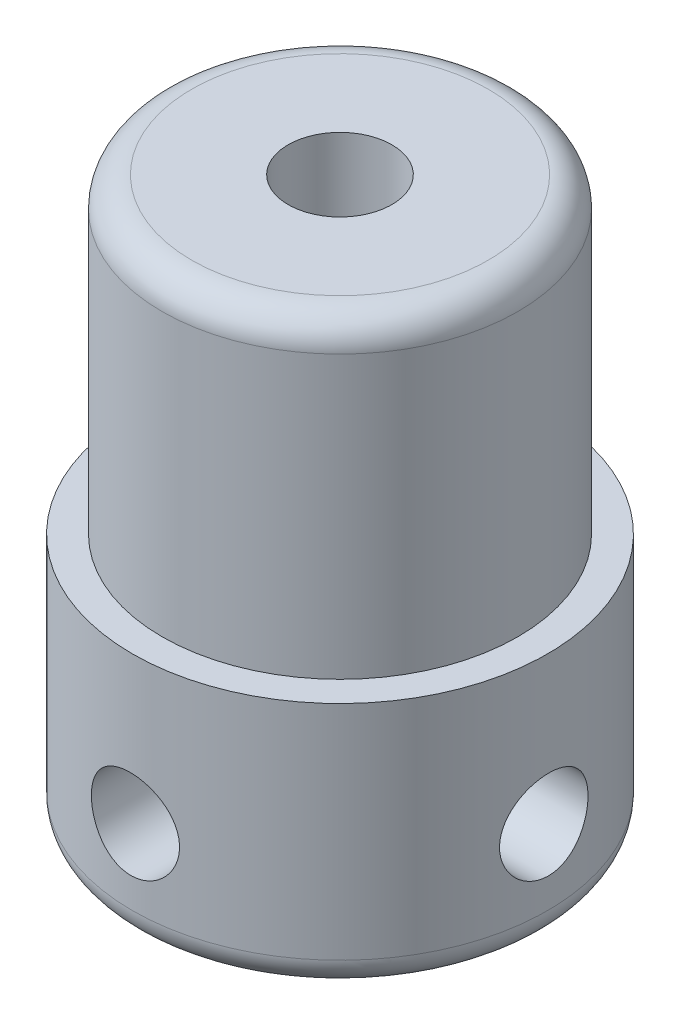
from build123d import *

# Parameters (mm, degrees)
SKETCH_1_R               = 7
SKETCH_1_R_2             = 3
EXTRUDE_1_DEPTH          = 8.5
SKETCH_2_R               = 6
SKETCH_2_R_2             = 1.75
EXTRUDE_2_DEPTH          = 10.5
FILLET_1_R               = 1
SKETCH_3_R               = 1.5
CUT_EXTRUDE_1_DEPTH      = 14.5
CUT_EXTRUDE_2_DEPTH      = 6.5
CUT_EXTRUDE_2_DEPTH_BACK = 6.5
SKETCH_4_R               = 1.5


with BuildPart() as part:
    # 草图1 → 凸台-拉伸1 (new body)
    with BuildSketch(Plane(origin=(0, 0, 0), x_dir=(1, 0, 0), z_dir=(0, 1, 0))):
        with Locations((-14.312366838, 6.407280503)):
            Circle(SKETCH_1_R)
        with Locations((-14.312366838, 6.407280503)):
            Circle(SKETCH_1_R_2, mode=Mode.SUBTRACT)
    extrude(amount=EXTRUDE_1_DEPTH)

    # 草图2 → 凸台-拉伸2 (add)
    with BuildSketch(Plane(origin=(0, 8.5, 0), x_dir=(1, 0, 0), z_dir=(0, 1, 0))):
        with Locations((-14.312366838, 6.407280503)):
            Circle(SKETCH_2_R)
        with Locations((-14.312366838, 6.407280503)):
            Circle(SKETCH_2_R_2, mode=Mode.SUBTRACT)
    extrude(amount=EXTRUDE_2_DEPTH)

    # 圆角1
    fillet_1_edges = [part.edges().sort_by_distance(p)[0] for p in [
        (-21.312366838, 0, -6.407280503),
        (-20.312366838, 19, -6.407280503),
    ]]
    fillet(fillet_1_edges, radius=FILLET_1_R)

    # 草图3 → 切除-拉伸1 (cut)
    with BuildSketch(Plane(origin=(0, 0, 0), x_dir=(0, 0, -1), z_dir=(1, 0, 0))):
        with Locations((6.442812973, 3.5)):
            Circle(SKETCH_3_R)
    extrude(amount=-CUT_EXTRUDE_1_DEPTH, mode=Mode.SUBTRACT)

    # 草图4 → 切除-拉伸2 (cut, two sides: drawn at the far end of the back side and taken through both)
    with BuildSketch(Plane.XY.offset(-CUT_EXTRUDE_2_DEPTH_BACK)):
        with Locations((-14.374144883, 3.5)):
            Circle(SKETCH_4_R)
    extrude(amount=CUT_EXTRUDE_2_DEPTH + CUT_EXTRUDE_2_DEPTH_BACK, mode=Mode.SUBTRACT)


solid = part.part
